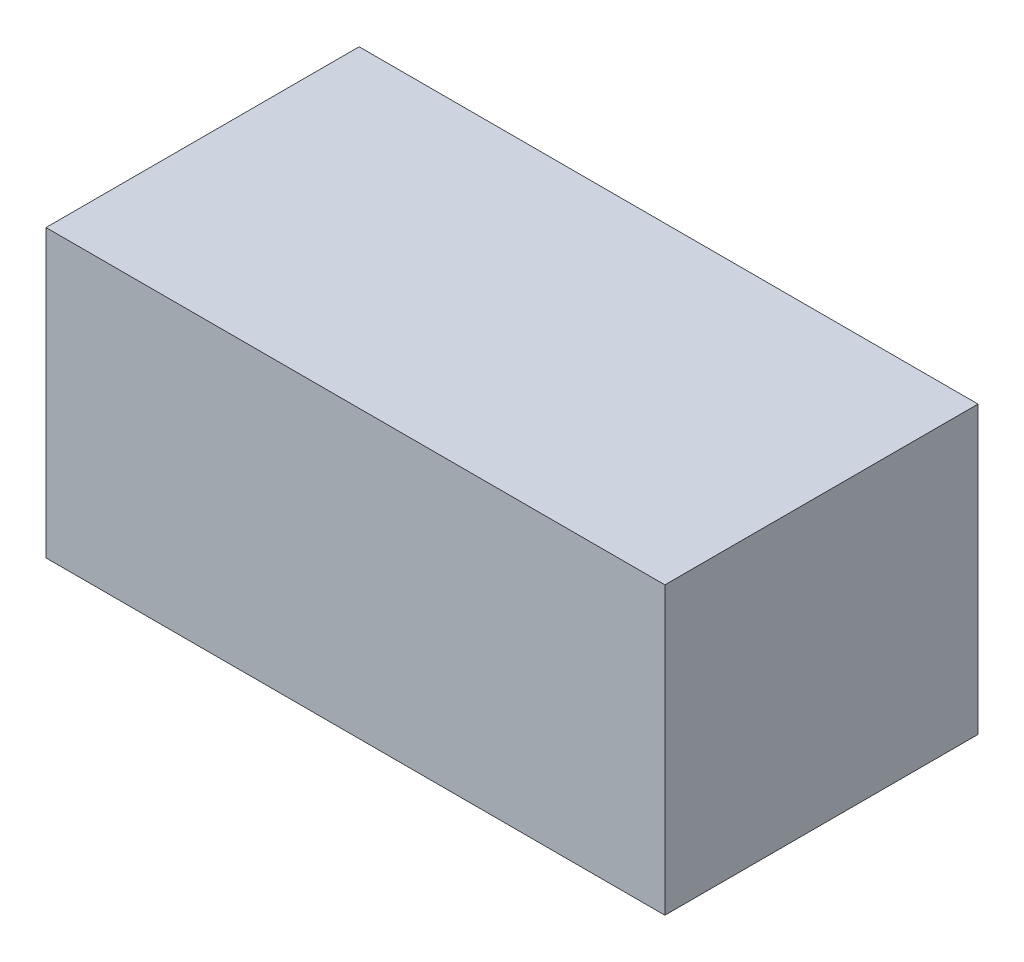
from build123d import *

# Parameters (mm, degrees)
SKETCH1_W           = 96.141413
SKETCH1_H           = 44.45
BOSS_EXTRUDE1_DEPTH = 48.6421938


with BuildPart() as part:
    # Sketch1 → Boss-Extrude1 (new body)
    with BuildSketch(Plane.XY):
        Rectangle(SKETCH1_W, SKETCH1_H)
    extrude(amount=BOSS_EXTRUDE1_DEPTH)


solid = part.part
